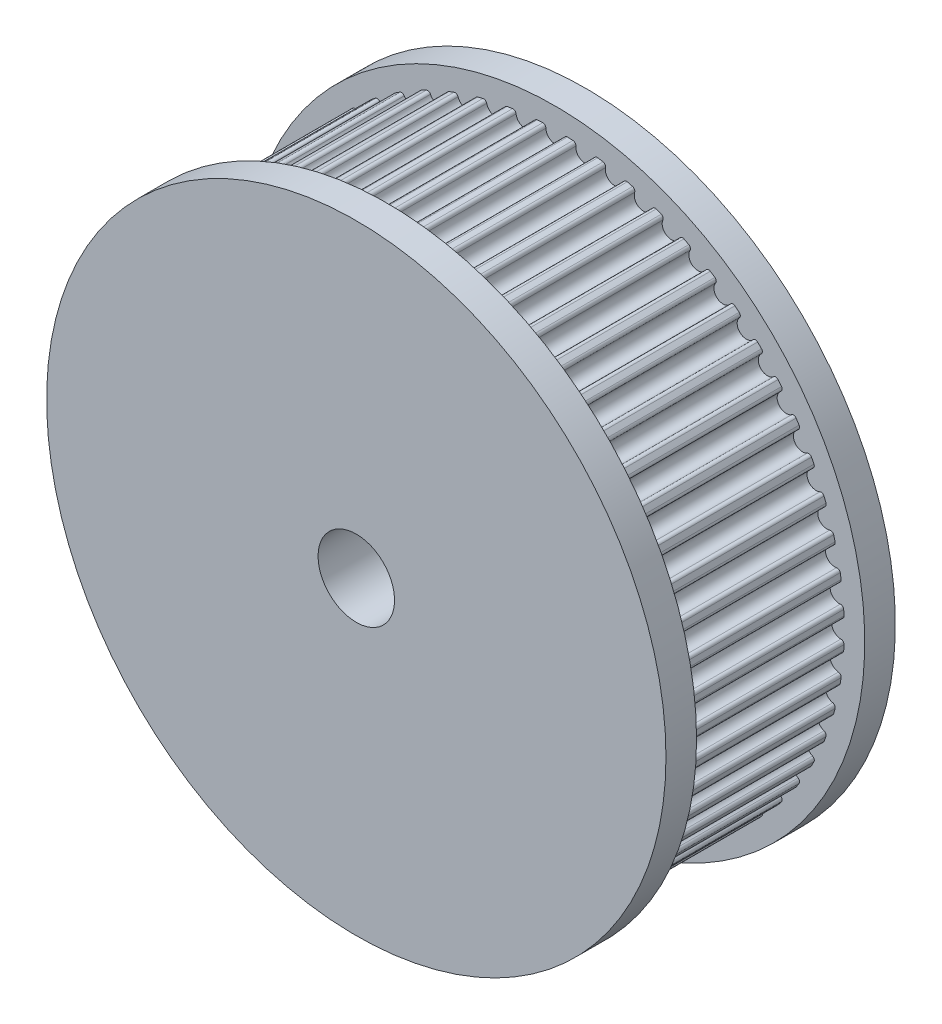
from build123d import *

# Parameters (mm, degrees)
SKETCHREVOLVEGEARBELT02_W       = 11
SKETCHREVOLVEGEARBELT02_H       = 18.908092887
TOOTHEXTRUDECUTGEARBELT02_DEPTH = 5.6
PATTERNGEARBELT02_COUNT         = 60
SKETCH5_R                       = 20.25
BOSS_EXTRUDE1_DEPTH             = 2
BOSS_EXTRUDE2_START             = 2
SKETCH6_R                       = 20.25
BOSS_EXTRUDE2_DEPTH             = 2
SKETCH7_R                       = 10
BOSS_EXTRUDE3_DEPTH             = 7
SKETCH8_R                       = 2.5
CUT_EXTRUDE2_DEPTH              = 37.112670906


with BuildPart() as part:
    # SketchRevolveGearBelt02 → GearBelt02 (revolve)
    with BuildSketch(Plane(origin=(0, 0, 0), x_dir=(0, 0, -1), z_dir=(1, 0, 0))):
        with Locations((0, 9.454046444)):
            Rectangle(SKETCHREVOLVEGEARBELT02_W, SKETCHREVOLVEGEARBELT02_H)
    revolve(axis=Axis((0, 0, 0), (0, 0, -1)))

    # SketchToothGearBelt02 → ToothExtrudeCutGearBelt02 (cut, symmetric)
    with BuildSketch(Plane.XY):
        with BuildLine():
            Line((-0.810458232, 18.890715552), (0, 21.448092849))
            Line((0, 21.448092849), (0.810458232, 18.890715552))
            ThreePointArc((0.810458232, 18.890715552), (0.662199993, 18.834818977), (0.599999991, 18.68909289))
            ThreePointArc((0.599999991, 18.68909289), (0, 18.089092899), (-0.599999991, 18.68909289))
            ThreePointArc((-0.599999991, 18.68909289), (-0.662199993, 18.834818977), (-0.810458232, 18.890715552))
        make_face()
    toothextrudecutgearbelt02 = extrude(amount=TOOTHEXTRUDECUTGEARBELT02_DEPTH, both=True, mode=Mode.SUBTRACT)

    # PatternGearBelt02: ToothExtrudeCutGearBelt02 ×60 about axis
    patterngearbelt02_axis = Axis((0, 0, 55), (0, 0, -1))
    for i in range(1, PATTERNGEARBELT02_COUNT):
        add(toothextrudecutgearbelt02.rotate(patterngearbelt02_axis, i * 360 / PATTERNGEARBELT02_COUNT), mode=Mode.SUBTRACT)

    # Sketch5 → Boss-Extrude1 (add)
    with BuildSketch(Plane.XY.offset(5.5)):
        Circle(SKETCH5_R)
    extrude(amount=BOSS_EXTRUDE1_DEPTH)

    # Sketch6 → Boss-Extrude2 (add)
    with BuildSketch(Plane(origin=(0, 0, -5.5), x_dir=(-1, 0, 0), z_dir=(0, 0, -1)).offset(BOSS_EXTRUDE2_START)):
        Circle(SKETCH6_R)
    extrude(amount=-BOSS_EXTRUDE2_DEPTH)

    # Sketch7 → Boss-Extrude3 (add)
    with BuildSketch(Plane(origin=(0, 0, -7.5), x_dir=(-1, 0, 0), z_dir=(0, 0, -1))):
        Circle(SKETCH7_R)
    extrude(amount=BOSS_EXTRUDE3_DEPTH)

    # Sketch8 → Cut-Extrude2 (cut, through all)
    with BuildSketch(Plane(origin=(0, 0, -14.5), x_dir=(-1, 0, 0), z_dir=(0, 0, -1))):
        Circle(SKETCH8_R)
    extrude(amount=-CUT_EXTRUDE2_DEPTH, mode=Mode.SUBTRACT)


solid = part.part
